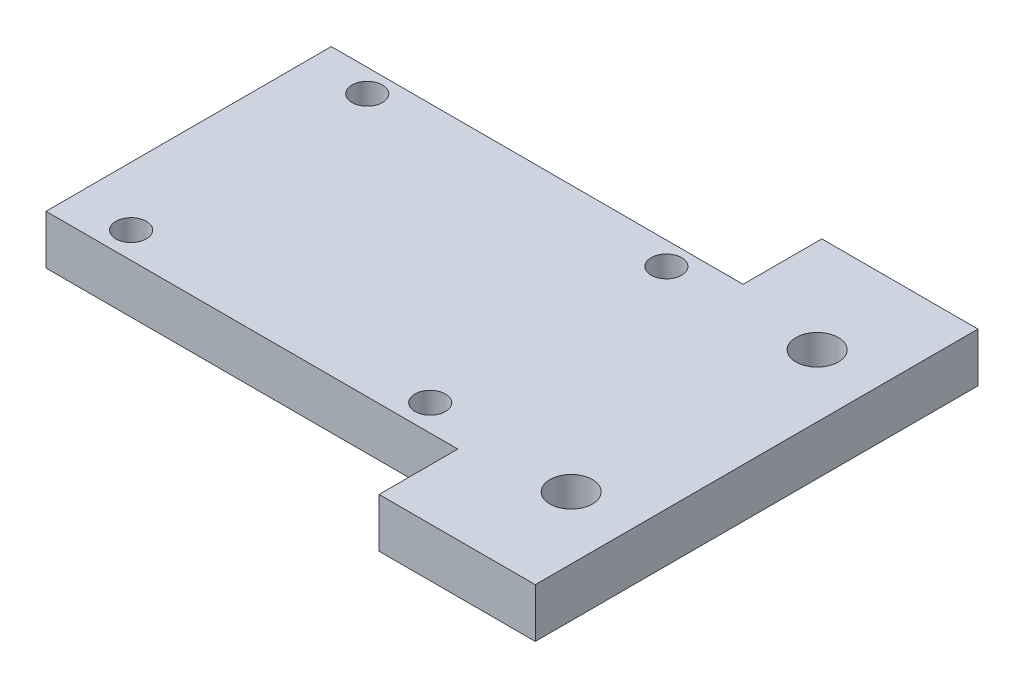
from build123d import *

# Parameters (mm, degrees)
SKETCH1_R           = 2.159
SKETCH1_R_2         = 1.55
BOSS_EXTRUDE1_DEPTH = 5
SKETCH2_W           = 32.727568347
SKETCH2_H           = 13.013122107
SKETCH2_W_2         = 39.41277834
SKETCH2_H_2         = 24.474392352
CUT_EXTRUDE1_DEPTH  = 58.151492497


with BuildPart() as part:
    # Sketch1 → Boss-Extrude1 (new body)
    with BuildSketch(Plane(origin=(0, 0, 0), x_dir=(1, 0, 0), z_dir=(0, 1, 0))):
        Polygon((36.55, 27.14922), (36.55, -43.65078), (20.675, -43.65078), (20.675, -31.173955128), (-21.18269604, -31.173955128), (-21.18269604, -2.173955128), (20.675, -2.173955128), (20.675, 27.14922), align=None)
        with Locations(Location((30.2, -29.173955128, 0), (0, 0, 90))):
            Circle(SKETCH1_R, mode=Mode.SUBTRACT)
        with Locations(Location((-15.2, -28.50156, 0), (0, 0, 90))):
            Circle(SKETCH1_R_2, mode=Mode.SUBTRACT)
        with Locations(Location((15.19999, -28.50156, 0), (0, 0, 270))):
            Circle(SKETCH1_R_2, mode=Mode.SUBTRACT)
        with Locations(Location((-15.2, -4.50156, 0), (0, 0, 270))):
            Circle(SKETCH1_R_2, mode=Mode.SUBTRACT)
        with Locations(Location((15.2, -4.50156, 0), (0, 0, 90))):
            Circle(SKETCH1_R_2, mode=Mode.SUBTRACT)
        with Locations(Location((30.2, -4.173955128, 0), (0, 0, 270))):
            Circle(SKETCH1_R, mode=Mode.SUBTRACT)
    extrude(amount=BOSS_EXTRUDE1_DEPTH)

    # Sketch2 → Cut-Extrude1 (cut, through all)
    with BuildSketch(Plane(origin=(0, 5, 0), x_dir=(1, 0, 0), z_dir=(0, 1, 0))):
        with Locations((29.057065878, -45.680516182)):
            Rectangle(SKETCH2_W, SKETCH2_H)
        with Locations((32.399670874, 18.063241048)):
            Rectangle(SKETCH2_W_2, SKETCH2_H_2)
    extrude(amount=-CUT_EXTRUDE1_DEPTH, mode=Mode.SUBTRACT)


solid = part.part
